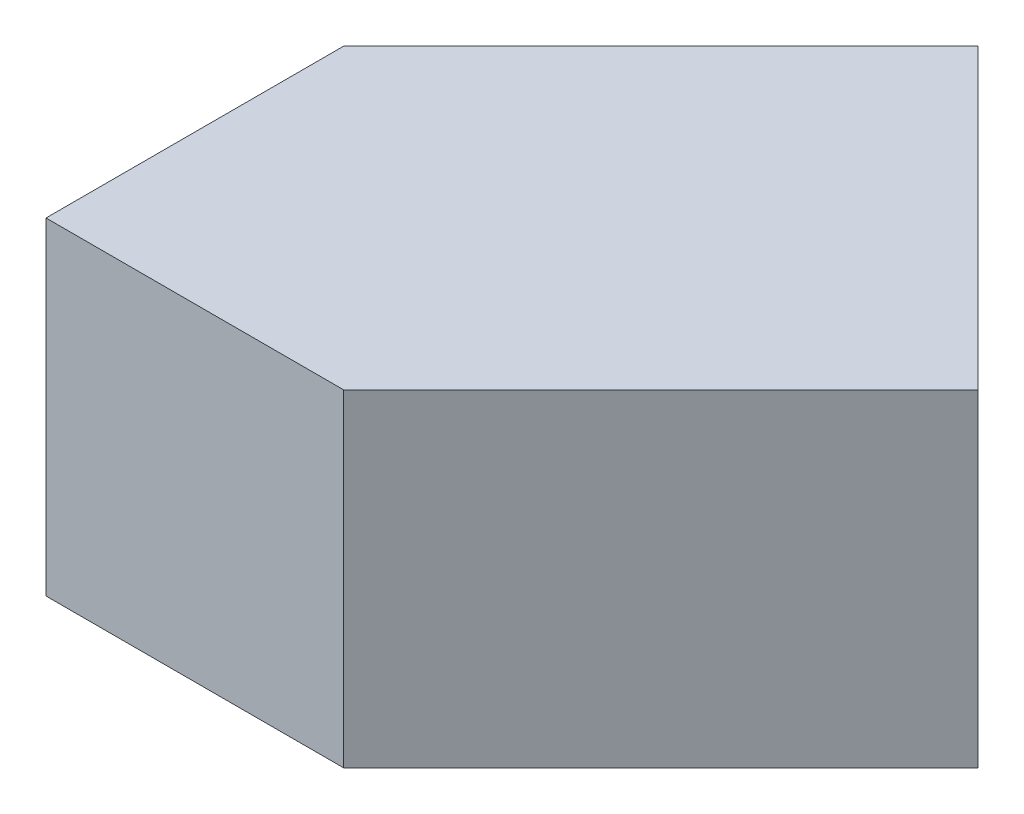
from build123d import *

# Parameters (mm, degrees)
SKETCH_1_W           = 25
SKETCH_1_H           = 25
SKETCH_1_W_2         = 20.2
SKETCH_1_H_2         = 20.2
EXTRUDE_1_DEPTH      = 20
SKETCH_2_W           = 25
SKETCH_2_H           = 25
EXTRUDE_2_DEPTH      = 7.5
EXTRUDE_3_DEPTH      = 17.67767
EXTRUDE_3_DEPTH_BACK = 20
SKETCH_3_W           = 35.35533906
SKETCH_3_H           = 27.5
SKETCH_3_W_2         = 20.2
SKETCH_3_H_2         = 20.2
SKETCH_1_3_W         = 20.2
SKETCH_1_3_H         = 20.2
CUT_EXTRUDE_1_DEPTH  = 23.85
SKETCH_3_2_W         = 20.2
SKETCH_3_2_H         = 20.2
CUT_EXTRUDE_2_DEPTH  = 20
EXTRUDE_4_REACH      = 62.275


with BuildPart() as part:
    # 스케치1 → 보스-돌출1 (new body)
    with BuildSketch(Plane(origin=(0, 0, 0), x_dir=(1, 0, 0), z_dir=(0, 1, 0))):
        Rectangle(SKETCH_1_W, SKETCH_1_H)
        Rectangle(SKETCH_1_W_2, SKETCH_1_H_2, mode=Mode.SUBTRACT)
    extrude(amount=EXTRUDE_1_DEPTH)

    # 스케치2 → 보스-돌출2 (add)
    with BuildSketch(Plane(origin=(0, 20, 0), x_dir=(1, 0, 0), z_dir=(0, 1, 0))):
        Rectangle(SKETCH_2_W, SKETCH_2_H)
    extrude(amount=EXTRUDE_2_DEPTH)

    # 스케치3 → 보스-돌출3 (add, two sides: drawn at the far end of the back side and taken through both)
    with BuildSketch(Plane(origin=(12.5, 0, -12.5), x_dir=(0.7071067811865476, 0, 0.7071067811865476), z_dir=(-0.7071067811865476, 0, 0.7071067811865476)).offset(-EXTRUDE_3_DEPTH_BACK)):
        with Locations((0, 13.75)):
            Rectangle(SKETCH_3_W, SKETCH_3_H)
        with Locations((0, 13.75)):
            Rectangle(SKETCH_3_W_2, SKETCH_3_H_2, mode=Mode.SUBTRACT)
    extrude(amount=EXTRUDE_3_DEPTH + EXTRUDE_3_DEPTH_BACK)

    # 스케치1<3> → 컷-돌출1 (cut)
    with BuildSketch(Plane(origin=(0, 0, 0), x_dir=(1, 0, 0), z_dir=(0, 1, 0))):
        Rectangle(SKETCH_1_3_W, SKETCH_1_3_H)
    extrude(amount=CUT_EXTRUDE_1_DEPTH, mode=Mode.SUBTRACT)

    # 스케치3<2> → 컷-돌출2 (cut)
    with BuildSketch(Plane(origin=(12.5, 0, -12.5), x_dir=(0.7071067811865476, 0, 0.7071067811865476), z_dir=(-0.7071067811865476, 0, 0.7071067811865476))):
        with Locations((0, 13.75)):
            Rectangle(SKETCH_3_2_W, SKETCH_3_2_H)
    extrude(amount=CUT_EXTRUDE_2_DEPTH, mode=Mode.SUBTRACT)

    # 스케치5 → 보스-돌출4 (add, up to next)
    with BuildSketch(Plane(origin=(0, 3.65, 0), x_dir=(1, 0, 0), z_dir=(0, 1, 0)), mode=Mode.PRIVATE) as extrude_4_sk1:
        Polygon((19.64177849, 5.35822151), (5.35822151, 19.64177849), (-4.18355698, 10.1), (10.1, 10.1), (10.1, -4.18355698), align=None)
    extrude_4_tool1 = extrude(extrude_4_sk1.sketch, amount=EXTRUDE_4_REACH, mode=Mode.PRIVATE) - part.part
    add(extrude_4_tool1.solids().sort_by_distance((12.261747, 3.65, -12.261747))[0])


solid = part.part
